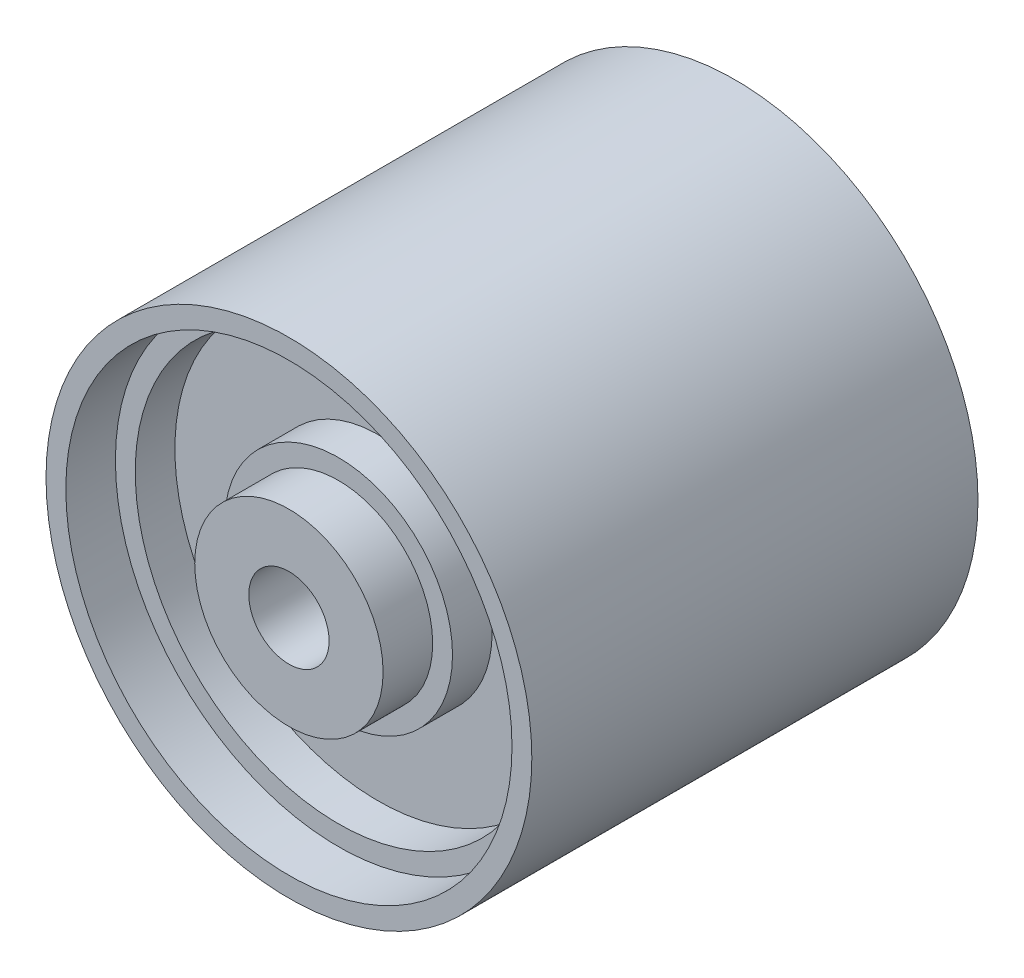
from build123d import *

# Parameters (mm, degrees)
SKETCH1_R           = 24.5
SKETCH1_R_2         = 4.05
BOSS_EXTRUDE1_DEPTH = 45
SKETCH2_R           = 20.5
SKETCH2_R_2         = 11.5
CUT_EXTRUDE1_DEPTH  = 9
CUT_EXTRUDE2_START  = -9
SKETCH3_R           = 20.5
SKETCH3_R_2         = 11.5
CUT_EXTRUDE2_DEPTH  = 9
SKETCH5_R           = 22.5
SKETCH5_R_2         = 9.5
CUT_EXTRUDE3_DEPTH  = 5
CUT_EXTRUDE4_START  = -5
SKETCH6_R           = 22.5
SKETCH6_R_2         = 9.5
CUT_EXTRUDE4_DEPTH  = 5


with BuildPart() as part:
    # Sketch1 → Boss-Extrude1 (new body)
    with BuildSketch(Plane.XY):
        Circle(SKETCH1_R)
        Circle(SKETCH1_R_2, mode=Mode.SUBTRACT)
    extrude(amount=-BOSS_EXTRUDE1_DEPTH)

    # Sketch2 → Cut-Extrude1 (cut)
    with BuildSketch(Plane.XY):
        Circle(SKETCH2_R)
        Circle(SKETCH2_R_2, mode=Mode.SUBTRACT)
    extrude(amount=-CUT_EXTRUDE1_DEPTH, mode=Mode.SUBTRACT)

    # Sketch3 → Cut-Extrude2 (cut)
    with BuildSketch(Plane(origin=(0, 0, -45), x_dir=(-1, 0, 0), z_dir=(0, 0, -1)).offset(CUT_EXTRUDE2_START)):
        with Locations(Location((0, 0, 0), (0, 0, 180))):
            Circle(SKETCH3_R)
        with Locations(Location((0, 0, 0), (0, 0, 180))):
            Circle(SKETCH3_R_2, mode=Mode.SUBTRACT)
    extrude(amount=CUT_EXTRUDE2_DEPTH, mode=Mode.SUBTRACT)

    # Sketch5 → Cut-Extrude3 (cut)
    with BuildSketch(Plane.XY):
        Circle(SKETCH5_R)
        Circle(SKETCH5_R_2, mode=Mode.SUBTRACT)
    extrude(amount=-CUT_EXTRUDE3_DEPTH, mode=Mode.SUBTRACT)

    # Sketch6 → Cut-Extrude4 (cut)
    with BuildSketch(Plane(origin=(0, 0, -45), x_dir=(-1, 0, 0), z_dir=(0, 0, -1)).offset(CUT_EXTRUDE4_START)):
        with Locations(Location((0, 0, 0), (0, 0, 180))):
            Circle(SKETCH6_R)
        with Locations(Location((0, 0, 0), (0, 0, 180))):
            Circle(SKETCH6_R_2, mode=Mode.SUBTRACT)
    extrude(amount=CUT_EXTRUDE4_DEPTH, mode=Mode.SUBTRACT)


solid = part.part
